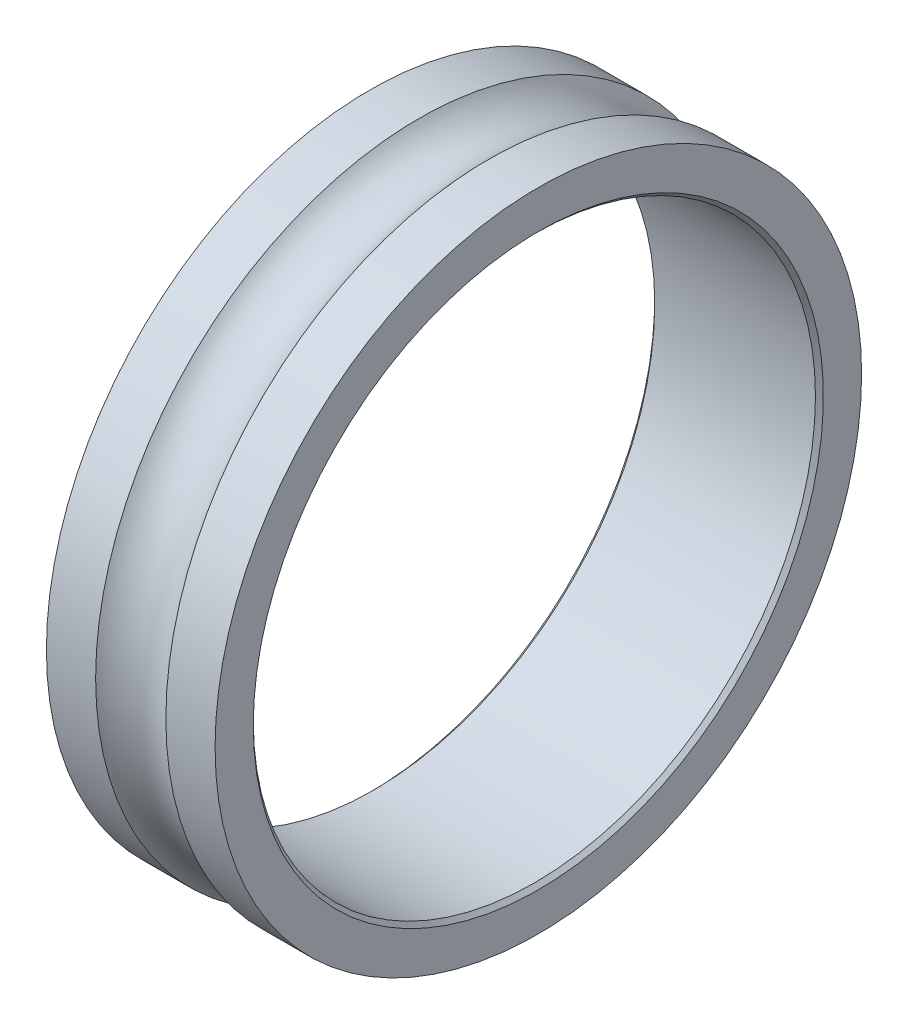
from build123d import *


with BuildPart() as part:
    # Szkic1 → Obrót1 (revolve)
    with BuildSketch(Plane.XY, mode=Mode.PRIVATE) as obr_t1_sk:
        with BuildLine():
            Line((-1.429289322, 5), (1.429289322, 5))
            Line((1.429289322, 5), (1.5, 5.070710678))
            Line((1.5, 5.070710678), (1.5, 5.75))
            Line((1.5, 5.75), (0.6244998, 5.75))
            ThreePointArc((0.6244998, 5.75), (0, 5.45), (-0.6244998, 5.75))
            Line((-0.6244998, 5.75), (-1.5, 5.75))
            Line((-1.5, 5.75), (-1.5, 5.070710678))
            Line((-1.5, 5.070710678), (-1.429289322, 5))
        make_face()
    revolve(obr_t1_sk.sketch.rotate(Axis((-1.5, 0, 0), (1, 0, 0)), 90), axis=Axis((-1.5, 0, 0), (1, 0, 0)))


solid = part.part
